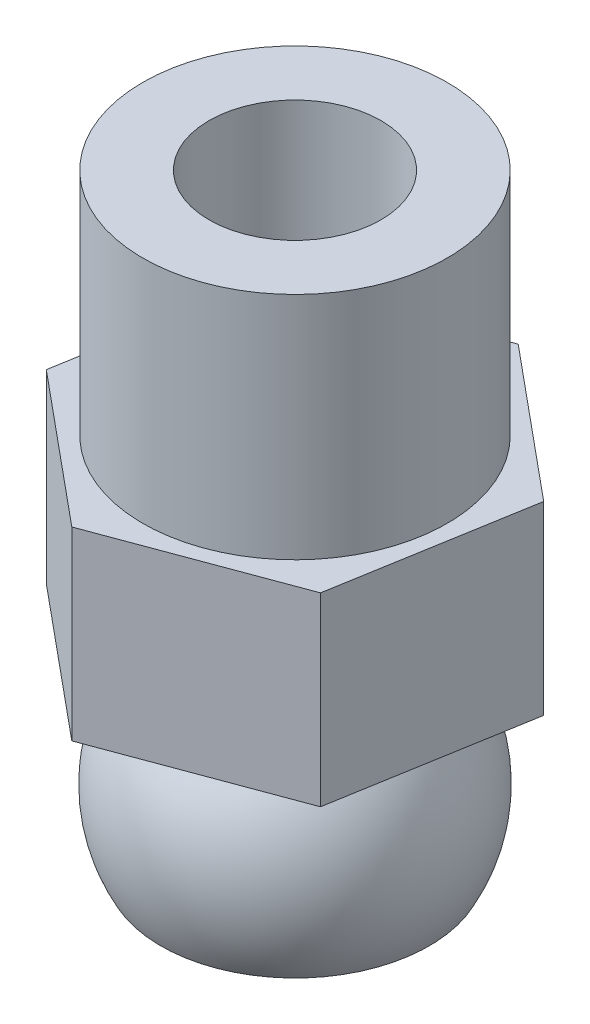
from build123d import *

# Parameters (mm, degrees)
CROQUIS1_W            = 2.662106529
CROQUIS1_H            = 9.24
CORTAR_EXTRUIR1_REACH = 25.043


with BuildPart() as part:
    # Croquis1 → Revolución1 (revolve)
    with BuildSketch(Plane.XY):
        with Locations((3.024759969, -0.663755178)):
            Rectangle(CROQUIS1_W, CROQUIS1_H)
        Polygon((4.355813233, -12.733755178), (4.355813233, -5.283755178), (1.693706704, -5.283755178), (0.033706704, -5.283755178), (0.033706704, -12.733755178), (3.465, -12.733755178), align=None)
        Polygon((4.355813233, -13.950813233), (4.355813233, -12.733755178), (3.465, -12.733755178), (3.465, -13.06), align=None)
        with BuildLine():
            Line((4.355813233, -14.607729599), (4.355813233, -13.950813233))
            Line((4.355813233, -13.950813233), (3.465, -13.06))
            Line((3.465, -13.06), (3.465, -16.464646325))
            ThreePointArc((3.465, -16.464646325), (3.80150201, -15.483943474), (4.355813233, -14.607729599))
        make_face()
        with BuildLine():
            Line((3.465, -16.464646325), (3.465, -13.06))
            ThreePointArc((3.465, -13.06), (1.725988008, -16.53567688), (2.418118888, -20.36))
            Line((2.418118888, -20.36), (3.465, -20.36))
            Line((3.465, -20.36), (3.465, -18.352767084))
            ThreePointArc((3.465, -18.352767084), (3.363706704, -17.408706704), (3.465, -16.464646325))
        make_face()
        with BuildLine():
            Line((3.465, -20.36), (4.355813233, -20.36))
            Line((4.355813233, -20.36), (3.909582187, -19.544195349))
            ThreePointArc((3.909582187, -19.544195349), (3.644512403, -18.964444111), (3.465, -18.352767084))
            Line((3.465, -18.352767084), (3.465, -20.36))
        make_face()
    revolve(axis=Axis((7.813706704, 3.956244822, 0), (0, -1, 0)))

    # Croquis2 → Cortar-Extruir1 (cut, up to next)
    with BuildSketch(Plane(origin=(0, -5.283755178, 0), x_dir=(-1, 0, 0), z_dir=(0, 1, 0)), mode=Mode.PRIVATE) as cortar_extruir1_sk1:
        with BuildLine():
            ThreePointArc((-6.509101958, 7.669837447), (-10.518804576, 7.294576445), (-13.803678403, 4.964739575))
            Line((-13.803678403, 4.964739575), (-6.509101958, 7.669837447))
        make_face()
    cortar_extruir1_tool1 = extrude(cortar_extruir1_sk1.sketch, amount=-CORTAR_EXTRUIR1_REACH, mode=Mode.PRIVATE) & part.part
    # Croquis2 → Cortar-Extruir1 (cut, up to next)
    with BuildSketch(Plane(origin=(0, -5.283755178, 0), x_dir=(-1, 0, 0), z_dir=(0, 1, 0)), mode=Mode.PRIVATE) as cortar_extruir1_sk2:
        with BuildLine():
            Line((-15.108283149, -2.705097871), (-13.803678403, 4.964739575))
            ThreePointArc((-13.803678403, 4.964739575), (-15.483544151, 1.304604746), (-15.108283149, -2.705097871))
        make_face()
    cortar_extruir1_tool2 = extrude(cortar_extruir1_sk2.sketch, amount=-CORTAR_EXTRUIR1_REACH, mode=Mode.PRIVATE) & part.part
    # Croquis2 → Cortar-Extruir1 (cut, up to next)
    with BuildSketch(Plane(origin=(0, -5.283755178, 0), x_dir=(-1, 0, 0), z_dir=(0, 1, 0)), mode=Mode.PRIVATE) as cortar_extruir1_sk3:
        with BuildLine():
            Line((-9.11831145, -7.669837447), (-15.108283149, -2.705097871))
            ThreePointArc((-15.108283149, -2.705097871), (-12.77844628, -5.989971699), (-9.11831145, -7.669837447))
        make_face()
    cortar_extruir1_tool3 = extrude(cortar_extruir1_sk3.sketch, amount=-CORTAR_EXTRUIR1_REACH, mode=Mode.PRIVATE) & part.part
    # Croquis2 → Cortar-Extruir1 (cut, up to next)
    with BuildSketch(Plane(origin=(0, -5.283755178, 0), x_dir=(-1, 0, 0), z_dir=(0, 1, 0)), mode=Mode.PRIVATE) as cortar_extruir1_sk4:
        with BuildLine():
            Line((-1.823735006, -4.964739575), (-9.11831145, -7.669837447))
            ThreePointArc((-9.11831145, -7.669837447), (-5.108608833, -7.294576445), (-1.823735006, -4.964739575))
        make_face()
    cortar_extruir1_tool4 = extrude(cortar_extruir1_sk4.sketch, amount=-CORTAR_EXTRUIR1_REACH, mode=Mode.PRIVATE) & part.part
    # Croquis2 → Cortar-Extruir1 (cut, up to next)
    with BuildSketch(Plane(origin=(0, -5.283755178, 0), x_dir=(-1, 0, 0), z_dir=(0, 1, 0)), mode=Mode.PRIVATE) as cortar_extruir1_sk5:
        with BuildLine():
            ThreePointArc((-0.033706704, 0), (-0.156024133, 1.374153423), (-0.51913026, 2.705097871))
            Line((-0.51913026, 2.705097871), (-1.823735006, -4.964739575))
            ThreePointArc((-1.823735006, -4.964739575), (-0.494882351, -2.638789513), (-0.033706704, 0))
        make_face()
    cortar_extruir1_tool5 = extrude(cortar_extruir1_sk5.sketch, amount=-CORTAR_EXTRUIR1_REACH, mode=Mode.PRIVATE) & part.part
    # Croquis2 → Cortar-Extruir1 (cut, up to next)
    with BuildSketch(Plane(origin=(0, -5.283755178, 0), x_dir=(-1, 0, 0), z_dir=(0, 1, 0)), mode=Mode.PRIVATE) as cortar_extruir1_sk6:
        with BuildLine():
            ThreePointArc((-0.51913026, 2.705097871), (-2.848967129, 5.989971699), (-6.509101958, 7.669837447))
            Line((-6.509101958, 7.669837447), (-0.51913026, 2.705097871))
        make_face()
    cortar_extruir1_tool6 = extrude(cortar_extruir1_sk6.sketch, amount=-CORTAR_EXTRUIR1_REACH, mode=Mode.PRIVATE) & part.part
    add(cortar_extruir1_tool1.solids().sort_by_distance((10.302222, -5.283755, 6.710539))[0], mode=Mode.SUBTRACT)
    add(cortar_extruir1_tool2.solids().sort_by_distance((14.869461, -5.283755, 1.200152))[0], mode=Mode.SUBTRACT)
    add(cortar_extruir1_tool3.solids().sort_by_distance((12.380946, -5.283755, -5.510387))[0], mode=Mode.SUBTRACT)
    add(cortar_extruir1_tool4.solids().sort_by_distance((5.325191, -5.283755, -6.710539))[0], mode=Mode.SUBTRACT)
    add(cortar_extruir1_tool5.solids().sort_by_distance((0.757952, -5.283755, -1.200152))[0], mode=Mode.SUBTRACT)
    add(cortar_extruir1_tool6.solids().sort_by_distance((3.246467, -5.283755, 5.510387))[0], mode=Mode.SUBTRACT)


solid = part.part
